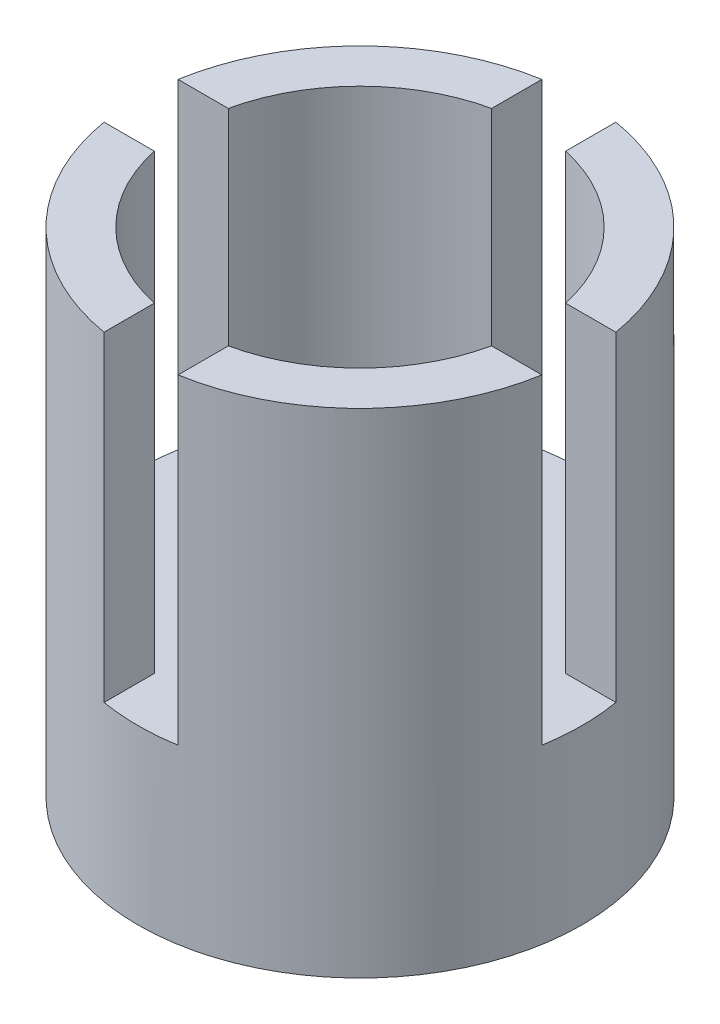
from build123d import *

# Parameters (mm, degrees)
SKETCH_1_R          = 9
EXTRUDE_1_DEPTH     = 20
CUT_EXTRUDE_1_DEPTH = 7
SKETCH_3_R          = 7
CUT_EXTRUDE_2_DEPTH = 13
CUT_EXTRUDE_3_DEPTH = 13
CUT_EXTRUDE_4_DEPTH = 13


with BuildPart() as part:
    # 草图1 → 凸台-拉伸1 (new body)
    with BuildSketch(Plane(origin=(0, 0, 0), x_dir=(1, 0, 0), z_dir=(0, 1, 0))):
        with Locations(Location((0, 0, 0), (0, 0, 270))):
            Circle(SKETCH_1_R)
    extrude(amount=EXTRUDE_1_DEPTH)

    # 草图2 → 切除-拉伸1 (cut)
    with BuildSketch(Plane(origin=(0, 0, 0), x_dir=(-1, 0, 0), z_dir=(0, -1, 0))):
        with BuildLine():
            Line((2.121320344, 1.75), (-2.121320344, 1.75))
            ThreePointArc((-2.121320344, 1.75), (-2.75, 0), (-2.121320344, -1.75))
            Line((-2.121320344, -1.75), (2.121320344, -1.75))
            ThreePointArc((2.121320344, -1.75), (2.75, 0), (2.121320344, 1.75))
        make_face()
    extrude(amount=-CUT_EXTRUDE_1_DEPTH, mode=Mode.SUBTRACT)

    # 草图3 → 切除-拉伸2 (cut)
    with BuildSketch(Plane(origin=(0, 20, 0), x_dir=(1, 0, 0), z_dir=(0, 1, 0))):
        with Locations(Location((0, 0, 0), (0, 0, 270))):
            Circle(SKETCH_3_R)
    extrude(amount=-CUT_EXTRUDE_2_DEPTH, mode=Mode.SUBTRACT)

    # 草图8 → 切除-拉伸3 (cut)
    with BuildSketch(Plane(origin=(0, 20, 0), x_dir=(1, 0, 0), z_dir=(0, 1, 0))):
        with BuildLine():
            Line((-1.5, -10.84621088), (-1.5, 10.935737737))
            ThreePointArc((-1.5, 10.935737737), (0, 12.435737737), (1.5, 10.935737737))
            Line((1.5, 10.935737737), (1.5, -10.84621088))
            ThreePointArc((1.5, -10.84621088), (0, -12.34621088), (-1.5, -10.84621088))
        make_face()
    extrude(amount=-CUT_EXTRUDE_3_DEPTH, mode=Mode.SUBTRACT)

    # 草图9 → 切除-拉伸4 (cut)
    with BuildSketch(Plane(origin=(0, 20, 0), x_dir=(1, 0, 0), z_dir=(0, 1, 0))):
        with BuildLine():
            Line((-9.142857143, 1.5), (9.171653543, 1.5))
            ThreePointArc((9.171653543, 1.5), (10.671653543, 0), (9.171653543, -1.5))
            Line((9.171653543, -1.5), (-9.142857143, -1.5))
            ThreePointArc((-9.142857143, -1.5), (-10.642857143, 0), (-9.142857143, 1.5))
        make_face()
    extrude(amount=-CUT_EXTRUDE_4_DEPTH, mode=Mode.SUBTRACT)


solid = part.part
